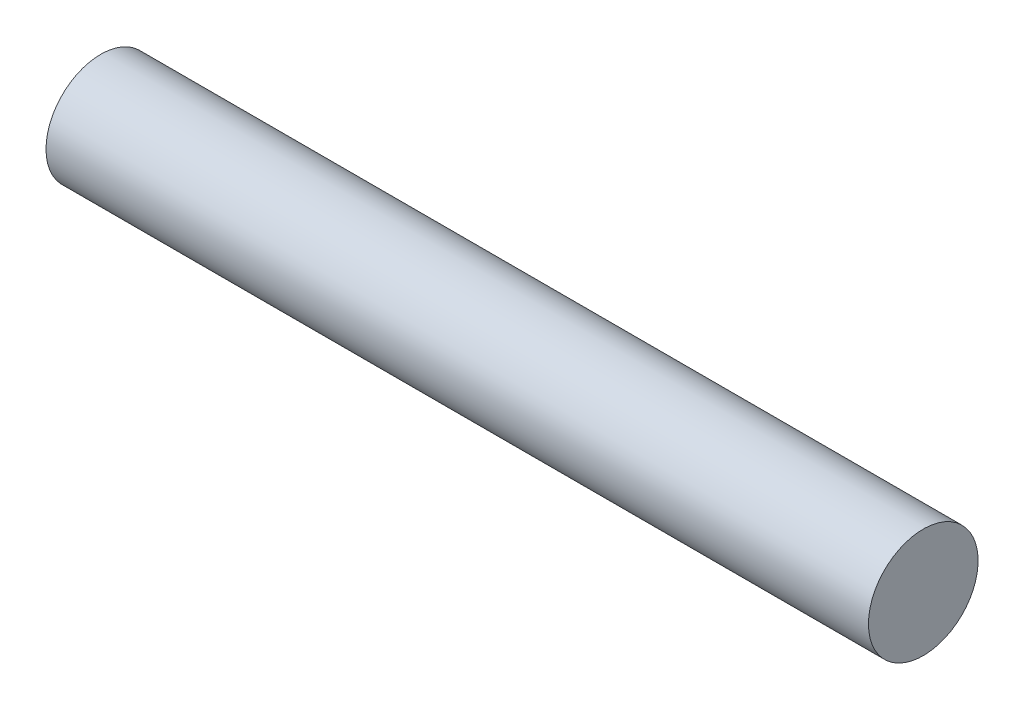
from build123d import *

# Parameters (mm, degrees)
SKETCH1_W = 114.3
SKETCH1_H = 7.62


with BuildPart() as part:
    # Sketch1 → Revolve10 (revolve)
    with BuildSketch(Plane.XY, mode=Mode.PRIVATE) as revolve10_sk:
        with Locations((0, 3.81)):
            Rectangle(SKETCH1_W, SKETCH1_H)
    revolve(revolve10_sk.sketch.rotate(Axis((-27.068427673, 0, 0), (1, 0, 0)), 90), axis=Axis((-27.068427673, 0, 0), (1, 0, 0)))


solid = part.part
